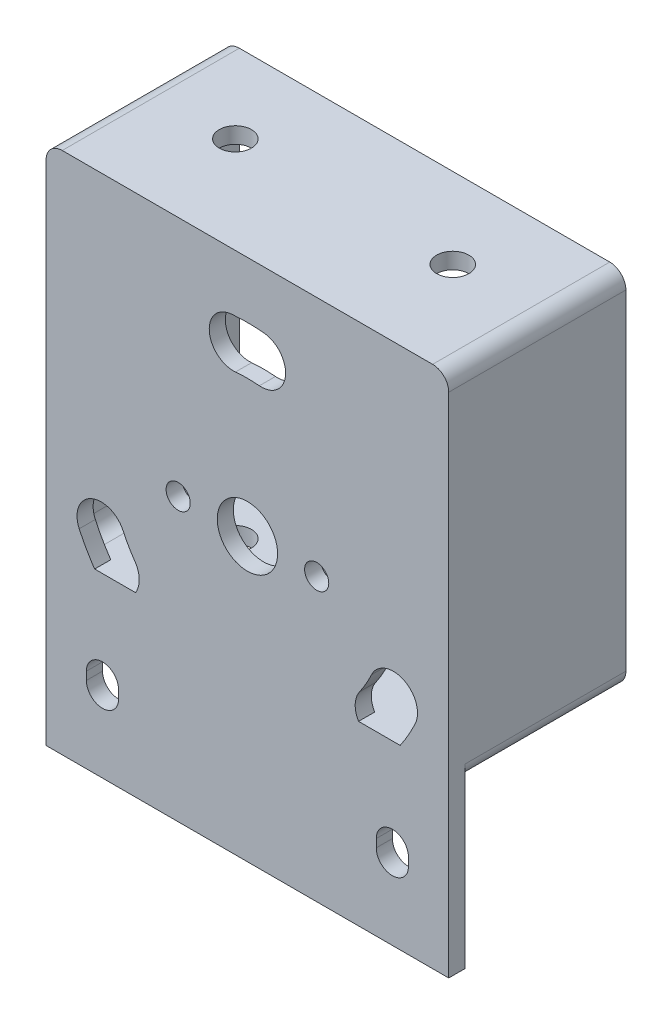
from build123d import *

# Parameters (mm, degrees)
SKETCH9_W               = 50
SKETCH9_H               = 50
SKETCH9_R               = 3.75
SKETCH9_R_2             = 1.5
BOSS_EXTRUDE2_DEPTH     = 2
BOSS_EXTRUDE3_DEPTH     = 20
SKETCH12_R              = 2
CUT_EXTRUDE1_DEPTH      = 2
CUT_EXTRUDE2_DEPTH      = 50
CUT_EXTRUDE2_DEPTH_BACK = 2
SKETCH13_R              = 2
SKETCH15_W              = 50
SKETCH15_H              = 15
BOSS_EXTRUDE4_DEPTH     = 2
CUT_EXTRUDE4_DEPTH      = 2
BOSS_EXTRUDE7_START     = 2
BOSS_EXTRUDE7_DEPTH     = 2
BOSS_EXTRUDE8_START     = 2
BOSS_EXTRUDE8_DEPTH     = 2
SKETCH17_W              = 50
SKETCH17_H              = 2
BOSS_EXTRUDE5_DEPTH     = 20
SKETCH19_R              = 2
CUT_EXTRUDE5_DEPTH      = 49
SKETCH20_W              = 2
SKETCH20_H              = 13
BOSS_EXTRUDE6_DEPTH     = 20
FILLET2_R               = 2
FILLET3_R               = 2
FILLET5_R               = 2
FILLET6_R               = 2
FILLET7_R               = 2
FILLET8_R               = 2
FILLET9_R               = 2
FILLET10_R              = 2


with BuildPart() as part:
    # Sketch9 → Boss-Extrude2 (new body)
    with BuildSketch(Plane.XY):
        with Locations((25, 25)):
            Rectangle(SKETCH9_W, SKETCH9_H)
        with Locations((25, 35)):
            Circle(SKETCH9_R, mode=Mode.SUBTRACT)
        with Locations((16.4, 35)):
            Circle(SKETCH9_R_2, mode=Mode.SUBTRACT)
        with Locations((33.6, 35)):
            Circle(SKETCH9_R_2, mode=Mode.SUBTRACT)
        with BuildLine():
            Line((9, 9.5), (9, 10.5))
            ThreePointArc((9, 10.5), (7, 12.5), (5, 10.5))
            Line((5, 10.5), (5, 9.5))
            ThreePointArc((5, 9.5), (7, 7.5), (9, 9.5))
        make_face(mode=Mode.SUBTRACT)
        with BuildLine():
            Line((45, 9.5), (45, 10.5))
            ThreePointArc((45, 10.5), (43, 12.5), (41, 10.5))
            Line((41, 10.5), (41, 9.5))
            ThreePointArc((41, 9.5), (43, 7.5), (45, 9.5))
        make_face(mode=Mode.SUBTRACT)
    extrude(amount=BOSS_EXTRUDE2_DEPTH)

    # Sketch11 → Boss-Extrude3 (add)
    with BuildSketch(Plane(origin=(0, 0, 0), x_dir=(-1, 0, 0), z_dir=(0, 0, -1))):
        Polygon((-48, 22), (-48, 50), (-50, 50), (-50, 20), (-28.5, 20), (-28.5, 22), align=None)
        Polygon((-7, 20), (0, 20), (0, 50), (-2, 50), (-2, 22), (-21.5, 22), (-21.5, 20), align=None)
    extrude(amount=BOSS_EXTRUDE3_DEPTH)

    # Sketch12 → Cut-Extrude1 (cut)
    with BuildSketch(Plane(origin=(0, 22, 0), x_dir=(1, 0, 0), z_dir=(0, 1, 0))):
        with Locations(Location((38.5, 10, 0), (0, 0, 180))):
            Circle(SKETCH12_R)
    extrude(amount=-CUT_EXTRUDE1_DEPTH, mode=Mode.SUBTRACT)

    # Sketch13 → Cut-Extrude2 (cut, two sides: drawn at the far end of the back side and taken through both)
    with BuildSketch(Plane(origin=(0, 22, 0), x_dir=(1, 0, 0), z_dir=(0, 1, 0)).offset(-CUT_EXTRUDE2_DEPTH_BACK)):
        with Locations(Location((11.5, 10, 0), (0, 0, 270))):
            Circle(SKETCH13_R)
    extrude(amount=CUT_EXTRUDE2_DEPTH + CUT_EXTRUDE2_DEPTH_BACK, mode=Mode.SUBTRACT)

    # Sketch15 → Boss-Extrude4 (add)
    with BuildSketch(Plane.XY.offset(2)):
        with Locations((25, 57.5)):
            Rectangle(SKETCH15_W, SKETCH15_H)
        with BuildLine():
            ThreePointArc((27.004582083, 57.912478056), (29.731698949, 54.662426734), (26.481647627, 51.935309868))
            ThreePointArc((26.481647627, 51.935309868), (25, 52), (23.518352373, 51.935309868))
            ThreePointArc((23.518352373, 51.935309868), (20.268301051, 54.662426734), (22.995417917, 57.912478056))
            ThreePointArc((22.995417917, 57.912478056), (25, 58), (27.004582083, 57.912478056))
        make_face(mode=Mode.SUBTRACT)
    extrude(amount=-BOSS_EXTRUDE4_DEPTH)

    # Sketch15<3> → Cut-Extrude4 (cut)
    with BuildSketch(Plane.XY.offset(2)):
        with BuildLine():
            ThreePointArc((6.101516985, 21.890944362), (10.276413331, 21.13580166), (11.031556032, 25.310698007))
            ThreePointArc((11.031556032, 25.310698007), (10.240231867, 26.564998835), (9.561238449, 27.883495115))
            ThreePointArc((9.561238449, 27.883495115), (5.580897313, 29.352128645), (4.112263784, 25.371787509))
            ThreePointArc((4.112263784, 25.371787509), (5.030901937, 23.5879396), (6.101516985, 21.890944362))
        make_face()
        with BuildLine():
            ThreePointArc((38.925584753, 25.249200582), (39.662311577, 21.07101514), (43.840497019, 21.807741964))
            ThreePointArc((43.840497019, 21.807741964), (44.918584287, 23.5), (45.845079102, 25.27977998))
            ThreePointArc((45.845079102, 25.27977998), (44.394010526, 29.266558126), (40.40723238, 27.81548955))
            ThreePointArc((40.40723238, 27.81548955), (39.722431864, 26.5), (38.925584753, 25.249200582))
        make_face()
    extrude(amount=-CUT_EXTRUDE4_DEPTH, mode=Mode.SUBTRACT)

    # Sketch21 → Boss-Extrude7 (add)
    with BuildSketch(Plane.XY.offset(BOSS_EXTRUDE7_START)):
        with BuildLine():
            Line((43.964469864, 22), (38.801611908, 22))
            ThreePointArc((38.801611908, 22), (41.268659486, 20.530652583), (43.840497019, 21.807741964))
            ThreePointArc((43.840497019, 21.807741964), (43.90431667, 21.90268887), (43.964469864, 22))
        make_face()
    extrude(amount=-BOSS_EXTRUDE7_DEPTH)

    # Sketch24 → Boss-Extrude8 (add)
    with BuildSketch(Plane.XY.offset(BOSS_EXTRUDE8_START)):
        with BuildLine():
            ThreePointArc((6.101516985, 21.890944362), (8.631925352, 20.601533886), (11.103734084, 22))
            Line((11.103734084, 22), (6.029338933, 22))
            ThreePointArc((6.029338933, 22), (6.064833637, 21.945078831), (6.101516985, 21.890944362))
        make_face()
    extrude(amount=-BOSS_EXTRUDE8_DEPTH)

    # Sketch17 → Boss-Extrude5 (add)
    with BuildSketch(Plane(origin=(0, 0, 0), x_dir=(-1, 0, 0), z_dir=(0, 0, -1))):
        with Locations((-25, 64)):
            Rectangle(SKETCH17_W, SKETCH17_H)
    extrude(amount=BOSS_EXTRUDE5_DEPTH)

    # Sketch19 → Cut-Extrude5 (cut)
    with BuildSketch(Plane(origin=(0, 65, 0), x_dir=(1, 0, 0), z_dir=(0, 1, 0))):
        with Locations(Location((38.5, 10, 0), (0, 0, 180))):
            Circle(SKETCH19_R)
        with Locations(Location((11.5, 10, 0), (0, 0, 270))):
            Circle(SKETCH19_R)
    extrude(amount=-CUT_EXTRUDE5_DEPTH, mode=Mode.SUBTRACT)

    # Sketch20 → Boss-Extrude6 (add)
    with BuildSketch(Plane(origin=(0, 0, 0), x_dir=(-1, 0, 0), z_dir=(0, 0, -1))):
        with Locations((-49, 56.5)):
            Rectangle(SKETCH20_W, SKETCH20_H)
        with Locations((-1, 56.5)):
            Rectangle(SKETCH20_W, SKETCH20_H)
    extrude(amount=BOSS_EXTRUDE6_DEPTH)

    # Fillet2
    fillet2_edges = [part.edges().sort_by_distance(p)[0] for p in [
        (0, 65, -9),
    ]]
    fillet(fillet2_edges, radius=FILLET2_R)

    # Fillet3
    fillet3_edges = [part.edges().sort_by_distance(p)[0] for p in [
        (50, 65, -9),
    ]]
    fillet(fillet3_edges, radius=FILLET3_R)

    # Fillet5
    fillet5_edges = [part.edges().sort_by_distance(p)[0] for p in [
        (50, 20, -10),
    ]]
    fillet(fillet5_edges, radius=FILLET5_R)

    # Fillet6
    fillet6_edges = [part.edges().sort_by_distance(p)[0] for p in [
        (0, 20, -10),
    ]]
    fillet(fillet6_edges, radius=FILLET6_R)

    # Fillet7
    fillet7_edges = [part.edges().sort_by_distance(p)[0] for p in [
        (48, 63, -10),
    ]]
    fillet(fillet7_edges, radius=FILLET7_R)

    # Fillet8
    fillet8_edges = [part.edges().sort_by_distance(p)[0] for p in [
        (2, 22, -10),
    ]]
    fillet(fillet8_edges, radius=FILLET8_R)

    # Fillet9
    fillet9_edges = [part.edges().sort_by_distance(p)[0] for p in [
        (2, 63, -10),
    ]]
    fillet(fillet9_edges, radius=FILLET9_R)

    # Fillet10
    fillet10_edges = [part.edges().sort_by_distance(p)[0] for p in [
        (48, 22, -10),
    ]]
    fillet(fillet10_edges, radius=FILLET10_R)


solid = part.part
